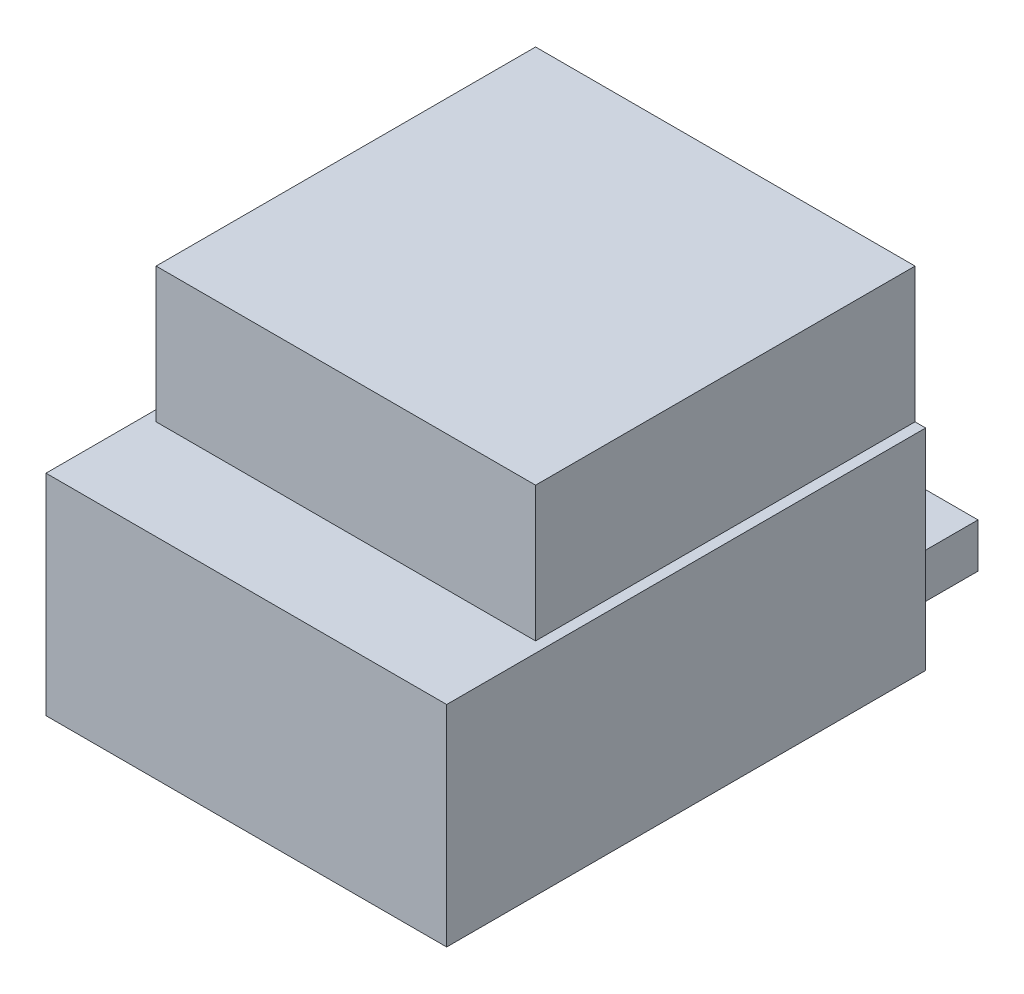
from build123d import *

# Parameters (mm, degrees)
SCHIZZO1_W                   = 31.57
SCHIZZO1_H                   = 37.74
ESTRUSIONE_ESTRUSIONE1_DEPTH = 16.55
SCHIZZO2_W                   = 29.9
SCHIZZO2_H                   = 29.9
ESTRUSIONE_ESTRUSIONE2_DEPTH = 10.63
ESTRUSIONE_ESTRUSIONE3_START = -2
SCHIZZO3_W                   = 26.14
SCHIZZO3_H                   = 6.84
ESTRUSIONE_ESTRUSIONE3_DEPTH = 3.5


with BuildPart() as part:
    # Schizzo1 → Estrusione-Estrusione1 (new body)
    with BuildSketch(Plane(origin=(0, 0, 0), x_dir=(1, 0, 0), z_dir=(0, 1, 0))):
        Rectangle(SCHIZZO1_W, SCHIZZO1_H)
    extrude(amount=ESTRUSIONE_ESTRUSIONE1_DEPTH)

    # Schizzo2 → Estrusione-Estrusione2 (add)
    with BuildSketch(Plane(origin=(0, 16.55, 0), x_dir=(1, 0, 0), z_dir=(0, 1, 0))):
        with Locations((0, 3.92)):
            Rectangle(SCHIZZO2_W, SCHIZZO2_H)
    extrude(amount=ESTRUSIONE_ESTRUSIONE2_DEPTH)

    # Schizzo3 → Estrusione-Estrusione3 (add)
    with BuildSketch(Plane.XZ.offset(ESTRUSIONE_ESTRUSIONE3_START)):
        with Locations((0, -22.29)):
            Rectangle(SCHIZZO3_W, SCHIZZO3_H)
    extrude(amount=-ESTRUSIONE_ESTRUSIONE3_DEPTH)


solid = part.part
